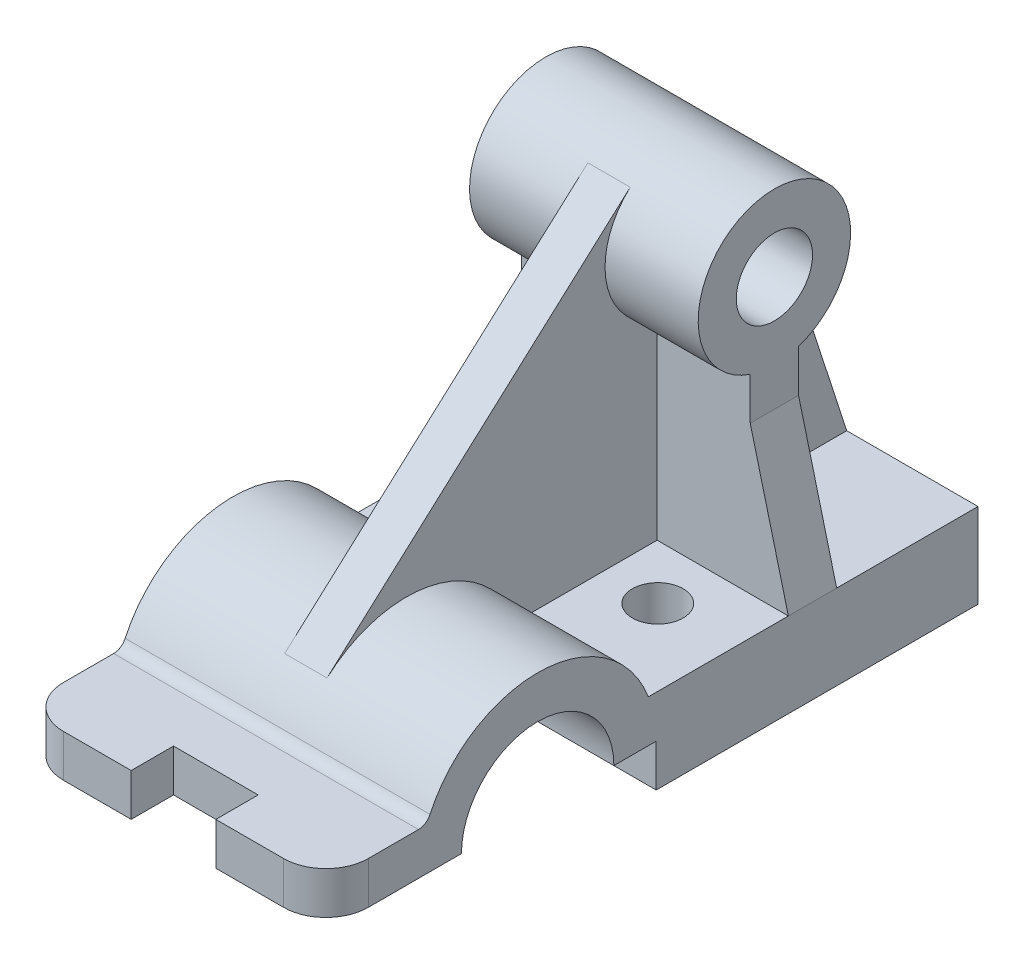
from build123d import *
from build123d.topology import SkipClean

# Parameters (mm, degrees)
BOSS_EXTRUDE1_DEPTH      = 20
SKETCH3_W                = 78
SKETCH3_H                = 10
CUT_EXTRUDE1_DEPTH       = 108.29864864
SKETCH5_W                = 20
SKETCH5_H                = 10
CUT_EXTRUDE2_DEPTH       = 88.321245983
BOSS_EXTRUDE3_DEPTH      = 72
SKETCH10_R               = 18
CUT_EXTRUDE4_DEPTH       = 113.058020686
SKETCH11_R               = 6
CUT_EXTRUDE5_DEPTH       = 88.321245983
SKETCH14_R               = 18
SKETCH14_R_2             = 9
BOSS_EXTRUDE4_DEPTH      = 72
SKETCH19_R               = 18
CUT_EXTRUDE6_DEPTH       = 9
BOSS_EXTRUDE5_DEPTH      = 9
BOSS_EXTRUDE5_DEPTH_BACK = 63
CUT_EXTRUDE8_DEPTH       = 42.619271
BOSS_EXTRUDE6_DEPTH      = 5
BOSS_EXTRUDE7_DEPTH      = 5


with BuildPart() as part:
    # Sketch1 → Boss-Extrude1 (new body)
    with BuildSketch(Plane(origin=(0, 0, 0), x_dir=(1, 0, 0), z_dir=(0, 1, 0))):
        with BuildLine():
            Line((-26, -77), (26, -77))
            ThreePointArc((26, -77), (33.071067812, -74.071067812), (36, -67))
            Line((36, -67), (36, 77))
            Line((36, 77), (-36, 77))
            Line((-36, 77), (-36, -67))
            ThreePointArc((-36, -67), (-33.071067812, -74.071067812), (-26, -77))
        make_face()
    extrude(amount=BOSS_EXTRUDE1_DEPTH)

    # Sketch3 → Cut-Extrude1 (cut, through all)
    with BuildSketch(Plane.ZY.offset(36)):
        with Locations((38, 5)):
            Rectangle(SKETCH3_W, SKETCH3_H)
    extrude(amount=-CUT_EXTRUDE1_DEPTH, mode=Mode.SUBTRACT)

    # Sketch5 → Cut-Extrude2 (cut, through all)
    with BuildSketch(Plane(origin=(0, 20, 0), x_dir=(1, 0, 0), z_dir=(0, 1, 0))):
        with Locations((0, -72)):
            Rectangle(SKETCH5_W, SKETCH5_H)
    extrude(amount=-CUT_EXTRUDE2_DEPTH, mode=Mode.SUBTRACT)

    # Sketch9 → Boss-Extrude3 (add, through all)
    with BuildSketch(Plane.ZY.offset(36)):
        with BuildLine():
            ThreePointArc((52.419027344, 21.741935484), (26.054797228, 37.984041733), (0.846606339, 20))
            Line((0.846606339, 20), (12.033370453, 20))
            ThreePointArc((12.033370453, 20), (27, 28), (41.966629547, 20))
            Line((41.966629547, 20), (53.153393661, 20))
            Line((53.153393661, 20), (55.142494559, 20))
            ThreePointArc((55.142494559, 20), (53.526046841, 20.472729382), (52.419027344, 21.741935484))
        make_face()
        with BuildLine():
            ThreePointArc((41.966629547, 20), (44.22497216, 15.22497216), (45, 10))
            Line((45, 10), (55, 10))
            ThreePointArc((55, 10), (54.534478591, 15.08453427), (53.153393661, 20))
            Line((53.153393661, 20), (41.966629547, 20))
        make_face()
        with BuildLine():
            ThreePointArc((0.846606339, 20), (-0.534478591, 15.08453427), (-1, 10))
            Line((-1, 10), (9, 10))
            ThreePointArc((9, 10), (9.77502784, 15.22497216), (12.033370453, 20))
            Line((12.033370453, 20), (0.846606339, 20))
        make_face()
    extrude(amount=-BOSS_EXTRUDE3_DEPTH)

    # Sketch10 → Cut-Extrude4 (cut, through all)
    with SkipClean():  # the faces are left unmerged after this step: merging them gives an invalid solid
        with BuildSketch(Plane.ZY.offset(36)):
            with Locations((27, 10)):
                Circle(SKETCH10_R)
        extrude(amount=-CUT_EXTRUDE4_DEPTH, mode=Mode.SUBTRACT)

    # Sketch11 → Cut-Extrude5 (cut, through all)
    with SkipClean():  # the faces are left unmerged after this step: merging them gives an invalid solid
        with BuildSketch(Plane(origin=(0, 20, 0), x_dir=(1, 0, 0), z_dir=(0, 1, 0))):
            with Locations(Location((-18, 19.367183159, 0), (0, 0, 270))):
                Circle(SKETCH11_R)
        cut_extrude5 = extrude(amount=-CUT_EXTRUDE5_DEPTH, mode=Mode.SUBTRACT)

    # Mirror1: Cut-Extrude5 across plane
    with SkipClean():  # the faces are left unmerged after this step: merging them gives an invalid solid
        add(cut_extrude5.mirror(Plane(origin=(0, 0, 0), x_dir=(0, 0, 1), z_dir=(1, 0, 0))), mode=Mode.SUBTRACT)



with BuildPart() as body_2:
    # Sketch14 → Boss-Extrude4 (new, through all)
    with BuildSketch(Plane.ZY.offset(36)):
        with Locations((-37.91461026, 82)):
            Circle(SKETCH14_R)
        with Locations((-37.91461026, 82)):
            Circle(SKETCH14_R_2, mode=Mode.SUBTRACT)
    extrude(amount=-BOSS_EXTRUDE4_DEPTH)

    # Sketch19 → Cut-Extrude6 (cut)
    with BuildSketch(Plane.ZY.offset(36)):
        with Locations((-37.91461026, 82)):
            Circle(SKETCH19_R)
    cut_extrude6 = extrude(amount=-CUT_EXTRUDE6_DEPTH, mode=Mode.SUBTRACT)

    # Mirror2: Cut-Extrude6 across plane
    add(cut_extrude6.mirror(Plane(origin=(0, 0, 0), x_dir=(0, 0, 1), z_dir=(1, 0, 0))), mode=Mode.SUBTRACT)

    # Sketch21 → Boss-Extrude5 (add, two sides: drawn at the far end of the back side and taken through both)
    with BuildSketch(Plane.ZY.offset(27).offset(-BOSS_EXTRUDE5_DEPTH_BACK)):
        with BuildLine():
            Line((-32.209949075, 19.927892902), (-43.619271445, 19.927892902))
            Line((-43.619271445, 19.927892902), (-43.619271445, 64.927892902))
            ThreePointArc((-43.619271445, 64.927892902), (-37.91461026, 64), (-32.209949075, 64.927892902))
            Line((-32.209949075, 64.927892902), (-32.209949075, 19.927892902))
        make_face()
    extrude(amount=BOSS_EXTRUDE5_DEPTH + BOSS_EXTRUDE5_DEPTH_BACK)

    # Sketch24 → Cut-Extrude8 (cut)
    with BuildSketch(Plane(origin=(0, 0, -43.619271445), x_dir=(-1, 0, 0), z_dir=(0, 0, -1))):
        Polygon((-27, 64.927892902), (-27, 54.927892902), (-36, 20), (-36, 64.927892902), align=None)
        Polygon((27, 64.927892902), (27, 54.927892902), (36, 20), (36, 64.927892902), align=None)
    extrude(amount=-CUT_EXTRUDE8_DEPTH, mode=Mode.SUBTRACT)


with BuildPart() as part_1:
    with SkipClean():  # the faces are left unmerged after this step: merging them gives an invalid solid
        add(part.part)

        add(body_2.part)  # Boss-Extrude6 merges body 2
        # Sketch30 → Boss-Extrude6 (add, symmetric)
        with BuildSketch(Plane(origin=(0, 0, 0), x_dir=(0, 0, -1), z_dir=(1, 0, 0))):
            with BuildLine():
                Line((-45.750774329, 30.794433439), (25.860541049, 95.367850068))
                ThreePointArc((25.860541049, 95.367850068), (20.293859016, 78.324523758), (32.209949075, 64.927892902))
                Line((32.209949075, 64.927892902), (32.209949075, 20))
                Line((32.209949075, 20), (-0.846606339, 20))
                ThreePointArc((-0.846606339, 20), (-20.455564076, 37.224444135), (-45.750774329, 30.794433439))
            make_face()
        extrude(amount=BOSS_EXTRUDE6_DEPTH, both=True)

    # Sketch31 → Boss-Extrude7 (add, symmetric)
    with SkipClean():  # the faces are left unmerged after this step: merging them gives an invalid solid
        with BuildSketch(Plane(origin=(0, 0, 0), x_dir=(0, 0, -1), z_dir=(1, 0, 0))):
            with BuildLine():
                Line((43.619271445, 64.927892902), (43.619271445, 20))
                Line((43.619271445, 20), (77, 20))
                Line((77, 20), (55.032581189, 87.565525247))
                ThreePointArc((55.032581189, 87.565525247), (53.987373983, 73.896527516), (43.619271445, 64.927892902))
            make_face()
        extrude(amount=BOSS_EXTRUDE7_DEPTH, both=True)


solid = part_1.part
